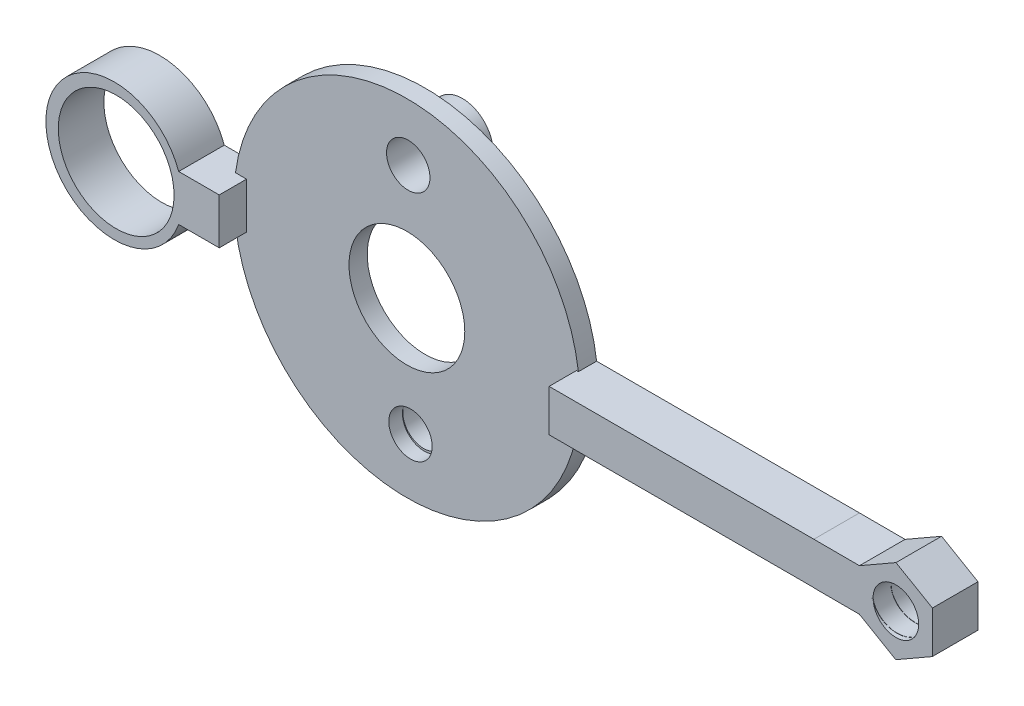
from build123d import *

# Parameters (mm, degrees)
BOSS_EXTRUDE1_DEPTH       = 10
CUT_EXTRUDE1_DEPTH        = 10
CUT_EXTRUDE1_DEPTH_BACK   = 10
SKETCH2_R                 = 5
CUT_SWEEP1_PITCH          = 4
CUT_SWEEP1_HEIGHT         = 10
CUT_SWEEP1_RADIUS         = 5
EXTRUDE_THIN2_DEPTH       = 10
BODY_MOVE_COPY1_ANGLE     = 2
SKETCH10_W                = 58.079037791
SKETCH10_H                = 9.197874715
BOSS_EXTRUDE2_DEPTH       = 10
SKETCH21_R                = 37.93035277
BOSS_EXTRUDE11_DEPTH      = 4
CUT_EXTRUDE5_DEPTH        = 4
CUT_EXTRUDE5_DEPTH_BACK   = 4
SKETCH22_R                = 12.7
CUT_EXTRUDE6_DEPTH        = 4
CUT_EXTRUDE6_DEPTH_BACK   = 4
SKETCH23_R                = 4.76
CUT_EXTRUDE7_DEPTH        = 4
CUT_EXTRUDE7_DEPTH_BACK   = 4
SKETCH24_R                = 4.76
BOSS_EXTRUDE13_DEPTH      = 1
BOSS_EXTRUDE13_DEPTH_BACK = 7.87
SKETCH27_R                = 6.76
CUT_EXTRUDE12_DEPTH       = 1
CUT_EXTRUDE12_DEPTH_BACK  = 7.87
SKETCH28_R                = 4.76
BOSS_EXTRUDE14_DEPTH      = 1
BOSS_EXTRUDE14_DEPTH_BACK = 7.87
SKETCH29_R                = 6.76
CUT_EXTRUDE13_DEPTH       = 1
CUT_EXTRUDE13_DEPTH_BACK  = 7.87
SKETCH30_R                = 4.585303289
SKETCH20_W                = 8.892243229
SKETCH20_H                = 10.060161684
BOSS_EXTRUDE15_DEPTH      = 10
SKETCH19_R                = 15
BOSS_EXTRUDE16_DEPTH      = 10
CUT_EXTRUDE14_DEPTH       = 10
CUT_EXTRUDE14_DEPTH_BACK  = 10
SKETCH31_R                = 12.7


with BuildPart() as part:
    # Sketch1 → Boss-Extrude1 (new body)
    with BuildSketch(Plane.XY):
        Polygon((-8.167579482, -4.315550803), (-0.346413115, -9.231106721), (7.821166368, -4.915555918), (8.167579482, 4.315550803), (0.346413115, 9.231106721), (-7.821166368, 4.915555918), align=None)
    extrude(amount=BOSS_EXTRUDE1_DEPTH)

    # Sketch2 → Cut-Extrude1 (cut, two sides: drawn at the far end of the back side and taken through both)
    with BuildSketch(Plane.XY.offset(-CUT_EXTRUDE1_DEPTH_BACK)):
        Circle(SKETCH2_R)
    extrude(amount=CUT_EXTRUDE1_DEPTH + CUT_EXTRUDE1_DEPTH_BACK, mode=Mode.SUBTRACT)

    # Cut-Sweep1: sweep along a helix
    with BuildLine() as cut_sweep1_path:
        Helix(CUT_SWEEP1_PITCH, CUT_SWEEP1_HEIGHT, CUT_SWEEP1_RADIUS, center=(0, 0, 0), direction=(0, 0, 1), lefthand=True)
    # Sketch4 → Cut-Sweep1 (sweep, cut)
    with BuildSketch(Plane.XY):
        Polygon((5.337109255, 0), (4.831445373, 0.291945178), (4.831445373, -0.291945178), align=None)
    sweep(path=cut_sweep1_path.line, is_frenet=True, mode=Mode.SUBTRACT)

    # Sketch6 → Extrude-Thin2 (add)
    with BuildSketch(Plane.XY):
        Polygon((-7.821166368, 4.915555918), (-8.167579482, -4.315550803), (-18.160545639, -3.940547606), (-17.814132524, 5.290559115), align=None)
    extrude(amount=EXTRUDE_THIN2_DEPTH)


with BuildPart() as part_1:
    # Body-Move/Copy1: moved
    add(part.part.rotate(Axis((-4.996483078, 0, 0), (0, 0, 1)), BODY_MOVE_COPY1_ANGLE))

    # Sketch10 → Boss-Extrude2 (add)
    with BuildSketch(Plane.XY):
        with Locations((-47.030481105, 0.241069377)):
            Rectangle(SKETCH10_W, SKETCH10_H)
    extrude(amount=BOSS_EXTRUDE2_DEPTH)

    # Sketch21 → Boss-Extrude11 (add)
    with BuildSketch(Plane.XY):
        with Locations((-113.262670717, 0)):
            Circle(SKETCH21_R)
    extrude(amount=BOSS_EXTRUDE11_DEPTH)

    # Sketch22 → Cut-Extrude5 (cut, two sides: drawn at the far end of the back side and taken through both)
    with BuildSketch(Plane.XY.offset(-CUT_EXTRUDE5_DEPTH_BACK)):
        with Locations((-113.262670717, 0)):
            Circle(SKETCH22_R)
    extrude(amount=CUT_EXTRUDE5_DEPTH + CUT_EXTRUDE5_DEPTH_BACK, mode=Mode.SUBTRACT)

    # Sketch23 → Cut-Extrude6 (cut, two sides: drawn at the far end of the back side and taken through both)
    with BuildSketch(Plane.XY.offset(-CUT_EXTRUDE6_DEPTH_BACK)):
        with Locations((-112.966619713, 25.4)):
            Circle(SKETCH23_R)
    extrude(amount=CUT_EXTRUDE6_DEPTH + CUT_EXTRUDE6_DEPTH_BACK, mode=Mode.SUBTRACT)

    # Sketch24 → Cut-Extrude7 (cut, two sides: drawn at the far end of the back side and taken through both)
    with BuildSketch(Plane.XY.offset(-CUT_EXTRUDE7_DEPTH_BACK)):
        with Locations((-112.471115727, -25.4)):
            Circle(SKETCH24_R)
    extrude(amount=CUT_EXTRUDE7_DEPTH + CUT_EXTRUDE7_DEPTH_BACK, mode=Mode.SUBTRACT)

    # Sketch27 → Boss-Extrude13 (add, two sides: drawn at the far end of the back side and taken through both)
    with BuildSketch(Plane.XY.offset(-BOSS_EXTRUDE13_DEPTH_BACK)):
        with Locations((-112.966619713, 25.4)):
            Circle(SKETCH27_R)
    extrude(amount=BOSS_EXTRUDE13_DEPTH + BOSS_EXTRUDE13_DEPTH_BACK)

    # Sketch28 → Cut-Extrude12 (cut, two sides: drawn at the far end of the back side and taken through both)
    with BuildSketch(Plane.XY.offset(-CUT_EXTRUDE12_DEPTH_BACK)):
        with Locations((-112.966619713, 25.4)):
            Circle(SKETCH28_R)
    extrude(amount=CUT_EXTRUDE12_DEPTH + CUT_EXTRUDE12_DEPTH_BACK, mode=Mode.SUBTRACT)

    # Sketch29 → Boss-Extrude14 (add, two sides: drawn at the far end of the back side and taken through both)
    with BuildSketch(Plane(origin=(-24.725624919, 0.221889436, 0), x_dir=(1, 0, 0), z_dir=(0, 0, 1)).offset(-BOSS_EXTRUDE14_DEPTH_BACK)):
        with Locations((-87.745490808, -25.657760722)):
            Circle(SKETCH29_R)
    extrude(amount=BOSS_EXTRUDE14_DEPTH + BOSS_EXTRUDE14_DEPTH_BACK)

    # Sketch30 → Cut-Extrude13 (cut, two sides: drawn at the far end of the back side and taken through both)
    with BuildSketch(Plane.XY.offset(-CUT_EXTRUDE13_DEPTH_BACK)):
        with Locations(Location((-112.583618689, -25.142193243, 0), (0, 0, 166.546290498))):
            Circle(SKETCH30_R)
    extrude(amount=CUT_EXTRUDE13_DEPTH + CUT_EXTRUDE13_DEPTH_BACK, mode=Mode.SUBTRACT)

    # Sketch20 → Boss-Extrude15 (add)
    with BuildSketch(Plane.XY):
        with Locations((-152.872413964, 0)):
            Rectangle(SKETCH20_W, SKETCH20_H)
    extrude(amount=BOSS_EXTRUDE15_DEPTH)

    # Sketch19 → Boss-Extrude16 (add)
    with BuildSketch(Plane.XY):
        with Locations((-171.45, 0)):
            Circle(SKETCH19_R)
    extrude(amount=BOSS_EXTRUDE16_DEPTH)

    # Sketch31 → Cut-Extrude14 (cut, two sides: drawn at the far end of the back side and taken through both)
    with BuildSketch(Plane.XY.offset(-CUT_EXTRUDE14_DEPTH_BACK)):
        with Locations((-171.028613762, 0)):
            Circle(SKETCH31_R)
    extrude(amount=CUT_EXTRUDE14_DEPTH + CUT_EXTRUDE14_DEPTH_BACK, mode=Mode.SUBTRACT)


solid = part_1.part
